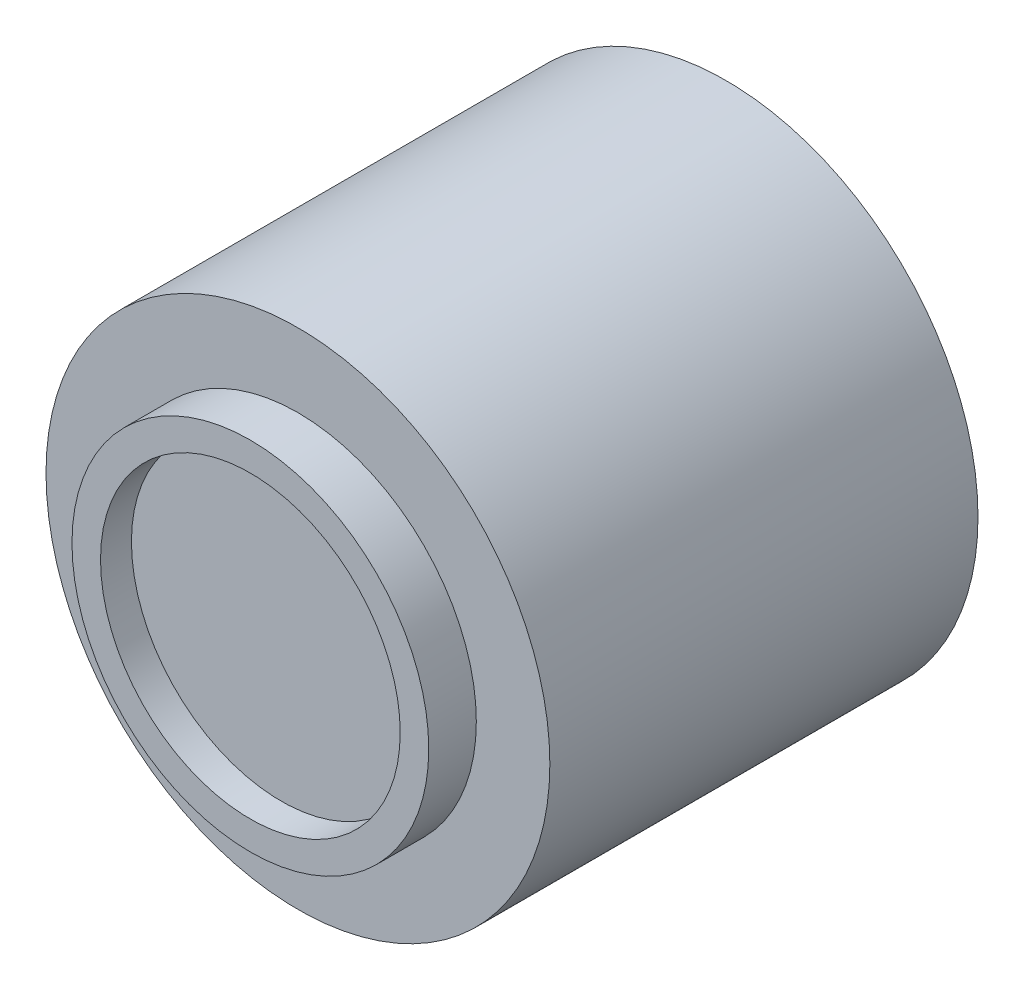
from build123d import *

# Parameters (mm, degrees)
SKETCH1_R           = 37.5
BOSS_EXTRUDE1_DEPTH = 100
SKETCH2_R           = 31.5
CUT_EXTRUDE1_DEPTH  = 6.5
SKETCH3_R           = 52.959705575
BOSS_EXTRUDE2_DEPTH = 90


with BuildPart() as part:
    # Sketch1 → Boss-Extrude1 (new body)
    with BuildSketch(Plane.XY):
        Circle(SKETCH1_R)
    extrude(amount=BOSS_EXTRUDE1_DEPTH)

    # Sketch2 → Cut-Extrude1 (cut)
    with BuildSketch(Plane.XY.offset(100)):
        Circle(SKETCH2_R)
    extrude(amount=-CUT_EXTRUDE1_DEPTH, mode=Mode.SUBTRACT)

    # Sketch3 → Boss-Extrude2 (add)
    with BuildSketch(Plane(origin=(0, 0, 0), x_dir=(-1, 0, 0), z_dir=(0, 0, -1))):
        Circle(SKETCH3_R)
    extrude(amount=-BOSS_EXTRUDE2_DEPTH)


solid = part.part
